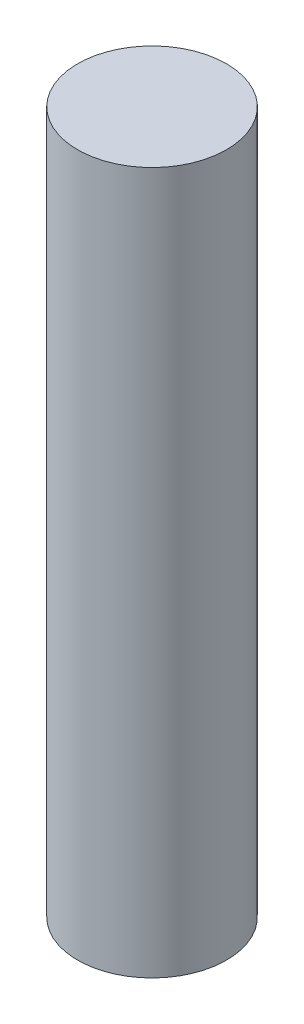
from build123d import *

# Parameters (mm, degrees)
SKETCH1_R           = 4.775
BOSS_EXTRUDE1_DEPTH = 45


with BuildPart() as part:
    # Sketch1 → Boss-Extrude1 (new body)
    with BuildSketch(Plane(origin=(0, 0, 0), x_dir=(1, 0, 0), z_dir=(0, 1, 0))):
        with Locations(Location((0, 0, 0), (0, 0, 90))):
            Circle(SKETCH1_R)
    extrude(amount=BOSS_EXTRUDE1_DEPTH)


solid = part.part
